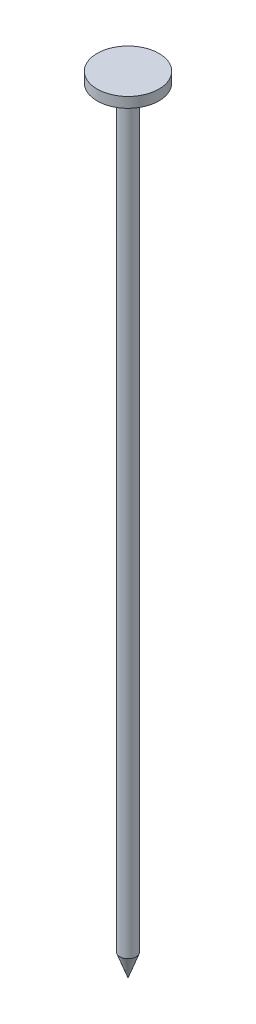
from build123d import *


with BuildPart() as part:
    # Sketch1 → Revolve1 (revolve)
    with BuildSketch(Plane.XY, mode=Mode.PRIVATE) as revolve1_sk:
        Polygon((0, 1), (3, 1), (3, 0), (0.79375, 0), (0.79375, -73.019189798), (0, -75.2), align=None)
    revolve(revolve1_sk.sketch.rotate(Axis((0, -75.2, 0), (0, 1, 0)), 90), axis=Axis((0, -75.2, 0), (0, 1, 0)))


solid = part.part
